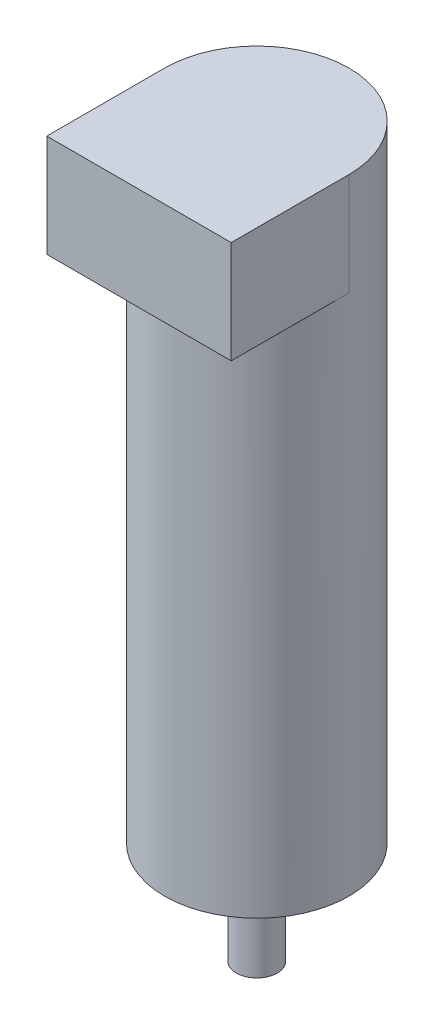
from build123d import *

# Parameters (mm, degrees)
SKETCH1_R           = 18
BOSS_EXTRUDE1_DEPTH = 102
SKETCH2_R           = 1.5
CUT_EXTRUDE1_DEPTH  = 5
CIRPATTERN1_COUNT   = 4
SKETCH3_R           = 11
BOSS_EXTRUDE2_DEPTH = 3
SKETCH4_R           = 4
BOSS_EXTRUDE3_DEPTH = 17
CUT_EXTRUDE2_START  = -15
CUT_EXTRUDE2_DEPTH  = 15
BOSS_EXTRUDE4_DEPTH = 20


with BuildPart() as part:
    # Sketch1 → Boss-Extrude1 (new body)
    with BuildSketch(Plane(origin=(0, 0, 0), x_dir=(1, 0, 0), z_dir=(0, 1, 0))):
        with Locations(Location((0, 0, 0), (0, 0, 270))):
            Circle(SKETCH1_R)
    extrude(amount=BOSS_EXTRUDE1_DEPTH)

    # Sketch2 → Cut-Extrude1 (cut)
    with BuildSketch(Plane.XZ):
        with Locations(Location((-15, 0, 0), (0, 0, 270))):
            Circle(SKETCH2_R)
    cut_extrude1 = extrude(amount=-CUT_EXTRUDE1_DEPTH, mode=Mode.SUBTRACT)

    # CirPattern1: Cut-Extrude1 ×4 about axis
    cirpattern1_axis = Axis((0, 0, 0), (0, 1, 0))
    for i in range(1, CIRPATTERN1_COUNT):
        add(cut_extrude1.rotate(cirpattern1_axis, i * 360 / CIRPATTERN1_COUNT), mode=Mode.SUBTRACT)

    # Sketch3 → Boss-Extrude2 (add)
    with BuildSketch(Plane.XZ):
        with Locations(Location((0, 0, 0), (0, 0, 90))):
            Circle(SKETCH3_R)
    extrude(amount=BOSS_EXTRUDE2_DEPTH)

    # Sketch4 → Boss-Extrude3 (add)
    with BuildSketch(Plane.XZ.offset(3)):
        with Locations(Location((0, 0, 0), (0, 0, 270))):
            Circle(SKETCH4_R)
    extrude(amount=BOSS_EXTRUDE3_DEPTH)

    # Sketch5 → Cut-Extrude2 (cut)
    with BuildSketch(Plane.XZ.offset(20).offset(CUT_EXTRUDE2_START)):
        with BuildLine():
            Line((-2.645751311, -3), (2.645751311, -3))
            ThreePointArc((2.645751311, -3), (0, -4), (-2.645751311, -3))
        make_face()
    extrude(amount=CUT_EXTRUDE2_DEPTH, mode=Mode.SUBTRACT)

    # Sketch7 → Boss-Extrude4 (add)
    with BuildSketch(Plane(origin=(0, 102, 0), x_dir=(1, 0, 0), z_dir=(0, 1, 0))):
        with BuildLine():
            Line((-18, 0), (-18, -23))
            Line((-18, -23), (18, -23))
            Line((18, -23), (18, 0))
            ThreePointArc((18, 0), (0, 18), (-18, 0))
        make_face()
    extrude(amount=BOSS_EXTRUDE4_DEPTH)


solid = part.part
